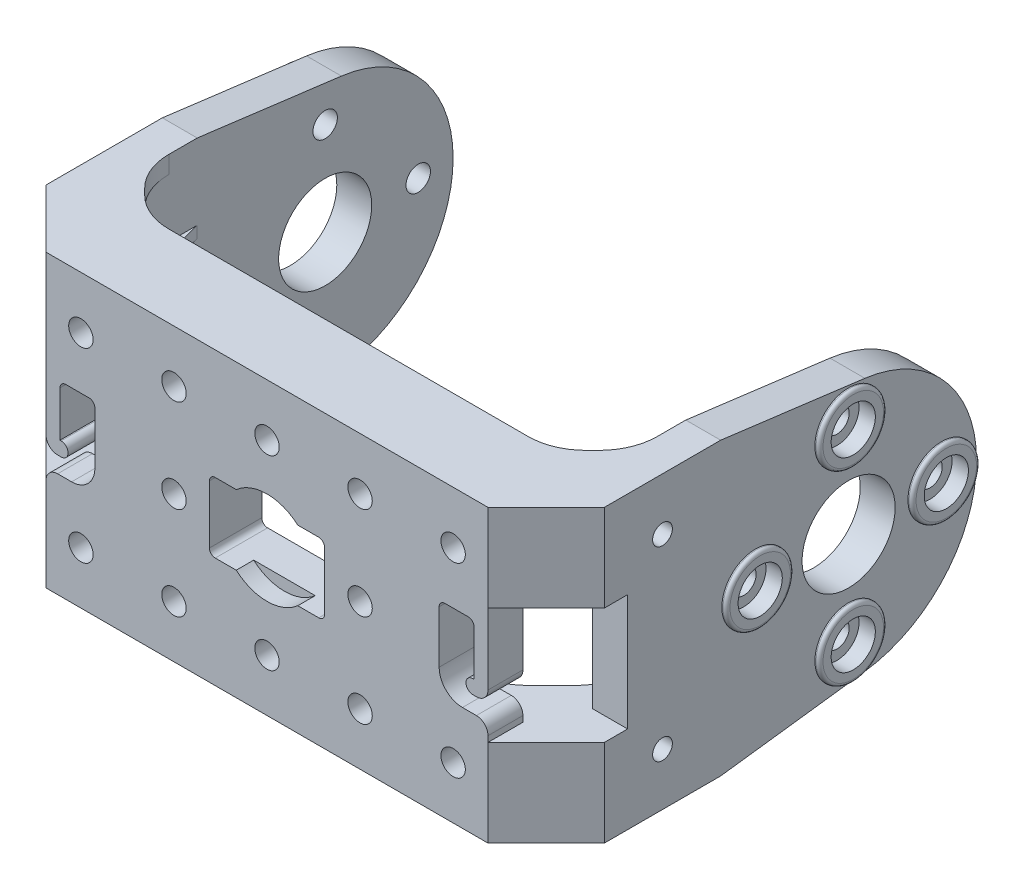
from build123d import *

# Parameters (mm, degrees)
BOSS_EXTRUDE1_DEPTH            = 1
BOSS_EXTRUDE2_DEPTH            = 0.5
CUT_EXTRUDE1_DEPTH             = 1
CUT_EXTRUDE2_DEPTH             = 1
CUT_EXTRUDE3_DEPTH             = 1
SKETCH6_W                      = 1.5
SKETCH6_H                      = 1.5
BOSS_EXTRUDE3_DEPTH            = 10.919112181
CUT_EXTRUDE4_DEPTH             = 1
BOSS_EXTRUDE4_DEPTH            = 7.5
BOSS_EXTRUDE5_DEPTH            = 7.5
CUT_EXTRUDE5_DEPTH             = 6
CUT_EXTRUDE6_DEPTH             = 6
BOSS_EXTRUDE6_DEPTH            = 3
BOSS_EXTRUDE7_START            = 3
BOSS_EXTRUDE7_DEPTH            = 3
CUT_EXTRUDE7_DEPTH             = 1.5
CUT_EXTRUDE8_DEPTH             = 1.5
CUT_EXTRUDE9_DEPTH             = 5
SKETCH17_W                     = 0.5
SKETCH17_H                     = 7
CUT_EXTRUDE10_DEPTH            = 1.743065645
CUT_EXTRUDE11_DEPTH            = 1.5
CUT_EXTRUDE12_DEPTH            = 1.5
CUT_EXTRUDE13_DEPTH            = 5
SKETCH21_W                     = 0.5
SKETCH21_H                     = 7
CUT_EXTRUDE14_DEPTH            = 2.337822174
SKETCH22_W                     = 0.5
SKETCH22_H                     = 7
CUT_EXTRUDE15_DEPTH            = 1.743065645
SKETCH23_W                     = 1.5
SKETCH23_H                     = 1.5
CUT_EXTRUDE16_DEPTH            = 8.985281374
SKETCH24_W                     = 0.5
SKETCH24_H                     = 7
CUT_EXTRUDE17_DEPTH            = 2.337822174
SKETCH25_W                     = 1.5
SKETCH25_H                     = 1.5
CUT_EXTRUDE18_DEPTH            = 0.419112181
BOSS_EXTRUDE8_DEPTH            = 3
CUT_EXTRUDE19_DEPTH            = 0.5
CUT_EXTRUDE20_DEPTH            = 1
CUT_EXTRUDE21_DEPTH            = 1
CUT_EXTRUDE22_DEPTH            = 1
CUT_EXTRUDE23_DEPTH            = 0.5
CUT_EXTRUDE24_DEPTH            = 1
CUT_EXTRUDE25_DEPTH            = 1
CUT_EXTRUDE26_DEPTH            = 1
CUT_EXTRUDE27_DEPTH            = 1
CUT_EXTRUDE28_DEPTH            = 1
CUT_EXTRUDE29_DEPTH            = 2
CUT_EXTRUDE30_DEPTH            = 1
CUT_EXTRUDE31_DEPTH            = 2
CUT_EXTRUDE32_DEPTH            = 1
CUT_EXTRUDE33_DEPTH            = 2
CUT_EXTRUDE34_DEPTH            = 1
CUT_EXTRUDE35_DEPTH            = 2
CUT_EXTRUDE36_DEPTH            = 1
CUT_EXTRUDE37_DEPTH            = 2
CUT_EXTRUDE38_DEPTH            = 1
CUT_EXTRUDE39_DEPTH            = 1
CUT_EXTRUDE40_DEPTH            = 2
CUT_EXTRUDE41_DEPTH            = 1
CUT_EXTRUDE42_DEPTH            = 1
SKETCH51_W                     = 9.9
SKETCH51_H                     = 6
CUT_EXTRUDE43_DEPTH            = 46.839393539
CUT_EXTRUDE44_DEPTH            = 1.5
CUT_EXTRUDE45_DEPTH            = 1.5
CUT_EXTRUDE46_DEPTH            = 2
CUT_EXTRUDE47_DEPTH            = 2
CUT_EXTRUDE48_DEPTH            = 2
CUT_EXTRUDE49_DEPTH            = 2
CUT_EXTRUDE50_DEPTH            = 2
CUT_EXTRUDE51_DEPTH            = 2
DRAFT1_ANGLE                   = 71.621107155
SKETCH60_W                     = 0.4
SKETCH60_H                     = 2.9
SKETCH61_W                     = 0.4
SKETCH61_H                     = 2.9
SKETCH62_W                     = 0.4
SKETCH62_H                     = 2.9
SKETCH63_W                     = 0.4
SKETCH63_H                     = 2.9
SKETCH64_W                     = 0.4
SKETCH64_H                     = 2.9
SKETCH65_W                     = 0.4
SKETCH65_H                     = 2.9
SKETCH66_W                     = 0.4
SKETCH66_H                     = 2.9
SKETCH67_W                     = 0.4
SKETCH67_H                     = 2.9
F_1_7_1_7_DIAMETER_HOLE1_D     = 1.7
F_1_7_1_7_DIAMETER_HOLE1_DEPTH = 3
F_1_7_1_7_DIAMETER_HOLE2_D     = 1.7
F_1_7_1_7_DIAMETER_HOLE2_DEPTH = 3.4
F_2_1_2_1_DIAMETER_HOLE1_D     = 2.1
F_2_1_2_1_DIAMETER_HOLE1_DEPTH = 37
HOLE1_D                        = 2.1
HOLE1_DEPTH                    = 3.4
HOLE1_CBORE_D                  = 3.8
HOLE1_CBORE_DEPTH              = 1.4
HOLE2_D                        = 2.1
HOLE2_DEPTH                    = 48.8
HOLE2_CBORE_D                  = 3.8
HOLE2_CBORE_DEPTH              = 1.4
F_8_0_8_DIAMETER_HOLE1_D       = 8
F_8_0_8_DIAMETER_HOLE1_DEPTH   = 3
F_8_0_8_DIAMETER_HOLE2_D       = 8
F_8_0_8_DIAMETER_HOLE2_DEPTH   = 3.4
CHAMFER1_SIZE                  = 5
FILLET1_R                      = 0.3
FILLET2_R                      = 0.5
FILLET3_R                      = 1
FILLET4_R                      = 2
FILLET5_R                      = 5


with BuildPart() as part:
    # Sketch1 → Boss-Extrude1 (new body)
    with BuildSketch(Plane.XY.offset(23)):
        Polygon((-14.595606444, -5), (10.080887819, -5), (10.080887819, -2.493640581), (11.2, -1.847520861), (11.2, 1.847520861), (10.080887819, 2.493640581), (10.080887819, 3.5), (14.595606444, 5), (-14.595606444, 5), (-10.080887819, 3.5), (-10.080887819, 2.493640581), (-11.2, 1.847520861), (-11.2, -1.847520861), (-10.080887819, -2.493640581), (-10.080887819, -3.5), align=None)
    extrude(amount=-BOSS_EXTRUDE1_DEPTH)

    # Sketch2 → Boss-Extrude2 (add)
    with BuildSketch(Plane(origin=(0, 0, 22), x_dir=(-1, 0, 0), z_dir=(0, 0, -1))):
        Polygon((-10.080887819, -5), (-10.080887819, 3.5), (-14.595606444, 5), (14.595606444, 5), (10.080887819, 3.5), (10.080887819, -3.5), (14.595606444, -5), align=None)
    extrude(amount=BOSS_EXTRUDE2_DEPTH)

    # Sketch3 → Cut-Extrude1 (cut)
    with BuildSketch(Plane.XY.offset(23)):
        Polygon((-8.337822174, -3.5), (-10.080887819, -2.493640581), (-10.080887819, -3.5), align=None)
    extrude(amount=-CUT_EXTRUDE1_DEPTH, mode=Mode.SUBTRACT)

    # Sketch4 → Cut-Extrude2 (cut)
    with BuildSketch(Plane.XY.offset(23)):
        Polygon((-10.080887819, 2.493640581), (-8.337822174, 3.5), (-10.080887819, 3.5), align=None)
    extrude(amount=-CUT_EXTRUDE2_DEPTH, mode=Mode.SUBTRACT)

    # Sketch5 → Cut-Extrude3 (cut)
    with BuildSketch(Plane.XY.offset(23)):
        Polygon((10.080887819, -2.493640581), (8.337822174, -3.5), (10.080887819, -3.5), align=None)
    extrude(amount=-CUT_EXTRUDE3_DEPTH, mode=Mode.SUBTRACT)

    # Sketch6 → Boss-Extrude3 (add)
    with BuildSketch(Plane(origin=(10.080887819, 0, 0), x_dir=(0, 0, -1), z_dir=(1, 0, 0))):
        with Locations((-22.25, -4.25)):
            Rectangle(SKETCH6_W, SKETCH6_H)
    extrude(amount=BOSS_EXTRUDE3_DEPTH)

    # Sketch7 → Cut-Extrude4 (cut)
    with BuildSketch(Plane.XY.offset(23)):
        Polygon((8.337822174, 3.5), (10.080887819, 2.493640581), (10.080887819, 3.5), align=None)
    extrude(amount=-CUT_EXTRUDE4_DEPTH, mode=Mode.SUBTRACT)

    # Sketch8 → Boss-Extrude4 (add)
    with BuildSketch(Plane.XZ.offset(5)):
        Polygon((-21, 11), (-21, 23), (21, 23), (21, 11), (19.5, 17.014718626), (17.514718626, 19), (-17.514718626, 19), (-19.5, 17.014718626), align=None)
    extrude(amount=BOSS_EXTRUDE4_DEPTH)

    # Sketch9 → Boss-Extrude5 (add)
    with BuildSketch(Plane(origin=(0, 5, 0), x_dir=(-1, 0, 0), z_dir=(0, 1, 0))):
        Polygon((21, 23), (21, 11), (19.5, 17.014718626), (17.514718626, 19), (-17.514718626, 19), (-19.5, 17.014718626), (-21, 11), (-21, 23), align=None)
    extrude(amount=BOSS_EXTRUDE5_DEPTH)

    # Sketch10 → Cut-Extrude5 (cut)
    with BuildSketch(Plane(origin=(0, -5, 0), x_dir=(-1, 0, 0), z_dir=(0, 1, 0))):
        Polygon((-17.514718626, 19), (17.514718626, 19), (15.014718626, 21.5), (-15.014718626, 21.5), align=None)
    extrude(amount=-CUT_EXTRUDE5_DEPTH, mode=Mode.SUBTRACT)

    # Sketch11 → Cut-Extrude6 (cut)
    with BuildSketch(Plane.XZ.offset(-5)):
        Polygon((-17.514718626, 19), (17.514718626, 19), (15.014718626, 21.5), (-15.014718626, 21.5), align=None)
    extrude(amount=-CUT_EXTRUDE6_DEPTH, mode=Mode.SUBTRACT)

    # Sketch12 → Boss-Extrude6 (add)
    with BuildSketch(Plane.ZY.offset(21)):
        with BuildLine():
            Line((23, 12.5), (23, 5))
            Line((23, 5), (19, 5))
            Line((19, 5), (19, -5))
            Line((19, -5), (23, -5))
            Line((23, -5), (23, -12.5))
            Line((23, -12.5), (11, -12.5))
            Line((11, -12.5), (-1.398557259, -10.910730388))
            ThreePointArc((-1.398557259, -10.910730388), (-11, 0), (-1.398557259, 10.910730388))
            Line((-1.398557259, 10.910730388), (11, 12.5))
            Line((11, 12.5), (23, 12.5))
        make_face()
    extrude(amount=BOSS_EXTRUDE6_DEPTH)

    # Sketch13 → Boss-Extrude7 (add)
    with BuildSketch(Plane(origin=(21, 0, 0), x_dir=(0, 0, -1), z_dir=(1, 0, 0)).offset(BOSS_EXTRUDE7_START)):
        with BuildLine():
            Line((-23, 12.5), (-11, 12.5))
            Line((-11, 12.5), (1.398557259, 10.910730388))
            ThreePointArc((1.398557259, 10.910730388), (11, 0), (1.398557259, -10.910730388))
            Line((1.398557259, -10.910730388), (-11, -12.5))
            Line((-11, -12.5), (-23, -12.5))
            Line((-23, -12.5), (-23, -3.5))
            Line((-23, -3.5), (-21.5, -3.5))
            Line((-21.5, -3.5), (-21.5, -5))
            Line((-21.5, -5), (-19, -5))
            Line((-19, -5), (-19, 5))
            Line((-19, 5), (-23, 5))
            Line((-23, 5), (-23, 12.5))
        make_face()
    extrude(amount=-BOSS_EXTRUDE7_DEPTH)

    # Sketch14 → Cut-Extrude7 (cut)
    with BuildSketch(Plane(origin=(0, 12.5, 0), x_dir=(-1, 0, 0), z_dir=(0, 1, 0))):
        Polygon((21, 11), (21, 15.514718626), (19.5, 17.014718626), align=None)
    extrude(amount=-CUT_EXTRUDE7_DEPTH, mode=Mode.SUBTRACT)

    # Sketch15 → Cut-Extrude8 (cut)
    with BuildSketch(Plane(origin=(0, 12.5, 0), x_dir=(-1, 0, 0), z_dir=(0, 1, 0))):
        Polygon((-21, 11), (-19.5, 17.014718626), (-21, 15.514718626), align=None)
    extrude(amount=-CUT_EXTRUDE8_DEPTH, mode=Mode.SUBTRACT)

    # Sketch16 → Cut-Extrude9 (cut)
    with BuildSketch(Plane(origin=(0, 11, 0), x_dir=(-1, 0, 0), z_dir=(0, 1, 0))):
        Polygon((21, 22), (-21, 22), (-21, 11), (-19.5, 17.014718626), (-15.014718626, 21.5), (15.014718626, 21.5), (19.5, 17.014718626), (21, 11), align=None)
    extrude(amount=-CUT_EXTRUDE9_DEPTH, mode=Mode.SUBTRACT)

    # Sketch17 → Cut-Extrude10 (cut)
    with BuildSketch(Plane(origin=(10.080887819, 0, 0), x_dir=(0, 0, -1), z_dir=(1, 0, 0))):
        with Locations((-21.75, 0)):
            Rectangle(SKETCH17_W, SKETCH17_H)
    extrude(amount=-CUT_EXTRUDE10_DEPTH, mode=Mode.SUBTRACT)

    # Sketch18 → Cut-Extrude11 (cut)
    with BuildSketch(Plane.XZ.offset(12.5)):
        Polygon((-19.5, 17.014718626), (-21, 15.514718626), (-21, 11), align=None)
    extrude(amount=-CUT_EXTRUDE11_DEPTH, mode=Mode.SUBTRACT)

    # Sketch19 → Cut-Extrude12 (cut)
    with BuildSketch(Plane.XZ.offset(12.5)):
        Polygon((21, 15.514718626), (19.5, 17.014718626), (21, 11), align=None)
    extrude(amount=-CUT_EXTRUDE12_DEPTH, mode=Mode.SUBTRACT)

    # Sketch20 → Cut-Extrude13 (cut)
    with BuildSketch(Plane.XZ.offset(11)):
        Polygon((21, 22), (-21, 22), (-21, 11), (-19.5, 17.014718626), (-15.014718626, 21.5), (15.014718626, 21.5), (19.5, 17.014718626), (21, 11), align=None)
    extrude(amount=-CUT_EXTRUDE13_DEPTH, mode=Mode.SUBTRACT)

    # Sketch21 → Cut-Extrude14 (cut)
    with BuildSketch(Plane(origin=(8.337822174, 0, 0), x_dir=(0, 0, -1), z_dir=(1, 0, 0))):
        with Locations((-21.75, 0)):
            Rectangle(SKETCH21_W, SKETCH21_H)
    extrude(amount=-CUT_EXTRUDE14_DEPTH, mode=Mode.SUBTRACT)

    # Sketch22 → Cut-Extrude15 (cut)
    with BuildSketch(Plane.ZY.offset(10.080887819)):
        with Locations((21.75, 0)):
            Rectangle(SKETCH22_W, SKETCH22_H)
    extrude(amount=-CUT_EXTRUDE15_DEPTH, mode=Mode.SUBTRACT)

    # Sketch23 → Cut-Extrude16 (cut)
    with BuildSketch(Plane(origin=(24, 0, 0), x_dir=(0, 0, -1), z_dir=(1, 0, 0))):
        with Locations((-22.25, -4.25)):
            Rectangle(SKETCH23_W, SKETCH23_H)
    extrude(amount=-CUT_EXTRUDE16_DEPTH, mode=Mode.SUBTRACT)

    # Sketch24 → Cut-Extrude17 (cut)
    with BuildSketch(Plane.ZY.offset(8.337822174)):
        with Locations((21.75, 0)):
            Rectangle(SKETCH24_W, SKETCH24_H)
    extrude(amount=-CUT_EXTRUDE17_DEPTH, mode=Mode.SUBTRACT)

    # Sketch25 → Cut-Extrude18 (cut)
    with BuildSketch(Plane(origin=(15.014718626, 0, 0), x_dir=(0, 0, -1), z_dir=(1, 0, 0))):
        with Locations((-22.25, -4.25)):
            Rectangle(SKETCH25_W, SKETCH25_H)
    extrude(amount=-CUT_EXTRUDE18_DEPTH, mode=Mode.SUBTRACT)

    # Sketch26 → Boss-Extrude8 (add)
    with BuildSketch(Plane.XY.offset(23)):
        with BuildLine():
            Line((14.8, 3.5), (14.8, -3.5))
            Line((14.8, -3.5), (19, -3.5))
            Line((19, -3.5), (19, -5))
            Line((19, -5), (24, -5))
            Line((24, -5), (24, -12.5))
            Line((24, -12.5), (-24, -12.5))
            Line((-24, -12.5), (-24, -5))
            Line((-24, -5), (-19, -5))
            Line((-19, -5), (-19, -3.5))
            Line((-19, -3.5), (-14.8, -3.5))
            Line((-14.8, -3.5), (-14.8, 3.5))
            Line((-14.8, 3.5), (-17.8, 3.5))
            Line((-17.8, 3.5), (-17.8, -0.9))
            Line((-17.8, -0.9), (-17.7, -0.9))
            ThreePointArc((-17.7, -0.9), (-17.1, -1.5), (-17.7, -2.1))
            Line((-17.7, -2.1), (-19, -2.1))
            Line((-19, -2.1), (-19, 5))
            Line((-19, 5), (-24, 5))
            Line((-24, 5), (-24, 12.5))
            Line((-24, 12.5), (24, 12.5))
            Line((24, 12.5), (24, 5))
            Line((24, 5), (19, 5))
            Line((19, 5), (19, -2.1))
            Line((19, -2.1), (17.7, -2.1))
            ThreePointArc((17.7, -2.1), (17.1, -1.5), (17.7, -0.9))
            Line((17.7, -0.9), (17.8, -0.9))
            Line((17.8, -0.9), (17.8, 3.5))
            Line((17.8, 3.5), (14.8, 3.5))
        make_face()
    extrude(amount=BOSS_EXTRUDE8_DEPTH)

    # Sketch27 → Cut-Extrude19 (cut)
    with BuildSketch(Plane(origin=(0, 0, 21.5), x_dir=(-1, 0, 0), z_dir=(0, 0, -1))):
        Polygon((-9.919112181, 4.5), (9.919112181, 4.5), (14.433830807, 6), (-14.433830807, 6), align=None)
    extrude(amount=-CUT_EXTRUDE19_DEPTH, mode=Mode.SUBTRACT)

    # Sketch28 → Cut-Extrude20 (cut)
    with BuildSketch(Plane(origin=(0, 0, 22), x_dir=(-1, 0, 0), z_dir=(0, 0, -1))):
        Polygon((9.919112181, 4.5), (13.810221356, 5.792807868), (12.535898385, 8), (14.267949192, 11), (9.203847577, 11), (11.2, 9.847520861), (11.2, 6.152479139), (8.337822174, 4.5), align=None)
    extrude(amount=-CUT_EXTRUDE20_DEPTH, mode=Mode.SUBTRACT)

    # Sketch29 → Cut-Extrude21 (cut)
    with BuildSketch(Plane(origin=(0, 0, 22), x_dir=(-1, 0, 0), z_dir=(0, 0, -1))):
        Polygon((7.662177826, 4.5), (4.8, 6.152479139), (4.8, 9.847520861), (6.796152423, 11), (1.203847577, 11), (3.2, 9.847520861), (3.2, 6.152479139), (0.337822174, 4.5), align=None)
    extrude(amount=-CUT_EXTRUDE21_DEPTH, mode=Mode.SUBTRACT)

    # Sketch30 → Cut-Extrude22 (cut)
    with BuildSketch(Plane(origin=(0, 0, 22), x_dir=(-1, 0, 0), z_dir=(0, 0, -1))):
        Polygon((-8.337822174, 4.5), (-11.2, 6.152479139), (-11.2, 9.847520861), (-9.203847577, 11), (-14.267949192, 11), (-12.535898385, 8), (-13.810221356, 5.792807868), (-9.919112181, 4.5), align=None)
    extrude(amount=-CUT_EXTRUDE22_DEPTH, mode=Mode.SUBTRACT)

    # Sketch31 → Cut-Extrude23 (cut)
    with BuildSketch(Plane(origin=(0, 0, 21.5), x_dir=(-1, 0, 0), z_dir=(0, 0, -1))):
        Polygon((9.919112181, -4.5), (-9.919112181, -4.5), (-14.433830807, -6), (14.433830807, -6), align=None)
    extrude(amount=-CUT_EXTRUDE23_DEPTH, mode=Mode.SUBTRACT)

    # Sketch32 → Cut-Extrude24 (cut)
    with BuildSketch(Plane(origin=(0, 0, 22), x_dir=(-1, 0, 0), z_dir=(0, 0, -1))):
        Polygon((-7.662177826, -4.5), (-4.8, -6.152479139), (-4.8, -9.847520861), (-6.796152423, -11), (-1.203847577, -11), (-3.2, -9.847520861), (-3.2, -6.152479139), (-0.337822174, -4.5), align=None)
    extrude(amount=-CUT_EXTRUDE24_DEPTH, mode=Mode.SUBTRACT)

    # Sketch33 → Cut-Extrude25 (cut)
    with BuildSketch(Plane(origin=(0, 0, 22), x_dir=(-1, 0, 0), z_dir=(0, 0, -1))):
        Polygon((-9.919112181, -4.5), (-13.810221356, -5.792807868), (-12.535898385, -8), (-14.267949192, -11), (-9.203847577, -11), (-11.2, -9.847520861), (-11.2, -6.152479139), (-8.337822174, -4.5), align=None)
    extrude(amount=-CUT_EXTRUDE25_DEPTH, mode=Mode.SUBTRACT)

    # Sketch34 → Cut-Extrude26 (cut)
    with BuildSketch(Plane(origin=(0, 0, 22), x_dir=(-1, 0, 0), z_dir=(0, 0, -1))):
        Polygon((-0.337822174, 4.5), (-3.2, 6.152479139), (-3.2, 9.847520861), (-1.203847577, 11), (-6.796152423, 11), (-4.8, 9.847520861), (-4.8, 6.152479139), (-7.662177826, 4.5), align=None)
    extrude(amount=-CUT_EXTRUDE26_DEPTH, mode=Mode.SUBTRACT)

    # Sketch35 → Cut-Extrude27 (cut)
    with BuildSketch(Plane(origin=(0, 0, 22), x_dir=(-1, 0, 0), z_dir=(0, 0, -1))):
        Polygon((8.337822174, -4.5), (11.2, -6.152479139), (11.2, -9.847520861), (9.203847577, -11), (14.267949192, -11), (12.535898385, -8), (13.810221356, -5.792807868), (9.919112181, -4.5), align=None)
    extrude(amount=-CUT_EXTRUDE27_DEPTH, mode=Mode.SUBTRACT)

    # Sketch36 → Cut-Extrude28 (cut)
    with BuildSketch(Plane(origin=(0, 0, 22), x_dir=(-1, 0, 0), z_dir=(0, 0, -1))):
        Polygon((0.337822174, -4.5), (3.2, -6.152479139), (3.2, -9.847520861), (1.203847577, -11), (6.796152423, -11), (4.8, -9.847520861), (4.8, -6.152479139), (7.662177826, -4.5), align=None)
    extrude(amount=-CUT_EXTRUDE28_DEPTH, mode=Mode.SUBTRACT)

    # Sketch37 → Cut-Extrude29 (cut)
    with BuildSketch(Plane(origin=(0, 0, 22), x_dir=(-1, 0, 0), z_dir=(0, 0, -1))):
        Polygon((-13.690598923, -8), (-14.845299462, -6), (-17.154700538, -6), (-18.309401077, -8), (-17.154700538, -10), (-14.845299462, -10), align=None)
    extrude(amount=-CUT_EXTRUDE29_DEPTH, mode=Mode.SUBTRACT)

    # Sketch38 → Cut-Extrude30 (cut)
    with BuildSketch(Plane(origin=(0, 0, 22), x_dir=(-1, 0, 0), z_dir=(0, 0, -1))):
        Polygon((-17.732050808, -11), (-19.464101615, -8), (-18.309401077, -6), (-21, -6), (-21, -11), align=None)
    extrude(amount=-CUT_EXTRUDE30_DEPTH, mode=Mode.SUBTRACT)

    # Sketch39 → Cut-Extrude31 (cut)
    with BuildSketch(Plane(origin=(0, 0, 22), x_dir=(-1, 0, 0), z_dir=(0, 0, -1))):
        Polygon((-14.845299462, 10), (-17.154700538, 10), (-18.309401077, 8), (-17.154700538, 6), (-14.845299462, 6), (-13.690598923, 8), align=None)
    extrude(amount=-CUT_EXTRUDE31_DEPTH, mode=Mode.SUBTRACT)

    # Sketch40 → Cut-Extrude32 (cut)
    with BuildSketch(Plane(origin=(0, 0, 22), x_dir=(-1, 0, 0), z_dir=(0, 0, -1))):
        Polygon((-17.732050808, 11), (-21, 11), (-21, 6), (-18.309401077, 6), (-19.464101615, 8), align=None)
    extrude(amount=-CUT_EXTRUDE32_DEPTH, mode=Mode.SUBTRACT)

    # Sketch41 → Cut-Extrude33 (cut)
    with BuildSketch(Plane(origin=(0, 0, 22), x_dir=(-1, 0, 0), z_dir=(0, 0, -1))):
        Polygon((13.690598923, 8), (14.845299462, 6), (17.154700538, 6), (18.309401077, 8), (17.154700538, 10), (14.845299462, 10), align=None)
    extrude(amount=-CUT_EXTRUDE33_DEPTH, mode=Mode.SUBTRACT)

    # Sketch42 → Cut-Extrude34 (cut)
    with BuildSketch(Plane(origin=(0, 0, 22), x_dir=(-1, 0, 0), z_dir=(0, 0, -1))):
        Polygon((17.732050808, 11), (19.464101615, 8), (18.309401077, 6), (21, 6), (21, 11), align=None)
    extrude(amount=-CUT_EXTRUDE34_DEPTH, mode=Mode.SUBTRACT)

    # Sketch43 → Cut-Extrude35 (cut)
    with BuildSketch(Plane(origin=(0, 0, 22), x_dir=(-1, 0, 0), z_dir=(0, 0, -1))):
        Polygon((14.845299462, -10), (17.154700538, -10), (18.309401077, -8), (17.154700538, -6), (14.845299462, -6), (13.690598923, -8), align=None)
    extrude(amount=-CUT_EXTRUDE35_DEPTH, mode=Mode.SUBTRACT)

    # Sketch44 → Cut-Extrude36 (cut)
    with BuildSketch(Plane(origin=(0, 0, 22), x_dir=(-1, 0, 0), z_dir=(0, 0, -1))):
        Polygon((17.732050808, -11), (21, -11), (21, -6), (18.309401077, -6), (19.464101615, -8), align=None)
    extrude(amount=-CUT_EXTRUDE36_DEPTH, mode=Mode.SUBTRACT)

    # Sketch45 → Cut-Extrude37 (cut)
    with BuildSketch(Plane(origin=(0, 0, 22), x_dir=(-1, 0, 0), z_dir=(0, 0, -1))):
        Polygon((-8, 2.309401077), (-10, 1.154700538), (-10, -1.154700538), (-8, -2.309401077), (-6, -1.154700538), (-6, 1.154700538), align=None)
    extrude(amount=-CUT_EXTRUDE37_DEPTH, mode=Mode.SUBTRACT)

    # Sketch46 → Cut-Extrude38 (cut)
    with BuildSketch(Plane(origin=(0, 0, 22), x_dir=(-1, 0, 0), z_dir=(0, 0, -1))):
        Polygon((-6, 3.5), (-7.662177826, 3.5), (-6, 2.540341184), align=None)
    extrude(amount=-CUT_EXTRUDE38_DEPTH, mode=Mode.SUBTRACT)

    # Sketch47 → Cut-Extrude39 (cut)
    with BuildSketch(Plane(origin=(0, 0, 22), x_dir=(-1, 0, 0), z_dir=(0, 0, -1))):
        Polygon((-6, -2.540341184), (-7.662177826, -3.5), (-6, -3.5), align=None)
    extrude(amount=-CUT_EXTRUDE39_DEPTH, mode=Mode.SUBTRACT)

    # Sketch48 → Cut-Extrude40 (cut)
    with BuildSketch(Plane(origin=(0, 0, 22), x_dir=(-1, 0, 0), z_dir=(0, 0, -1))):
        Polygon((8, 2.309401077), (6, 1.154700538), (6, -1.154700538), (8, -2.309401077), (10, -1.154700538), (10, 1.154700538), align=None)
    extrude(amount=-CUT_EXTRUDE40_DEPTH, mode=Mode.SUBTRACT)

    # Sketch49 → Cut-Extrude41 (cut)
    with BuildSketch(Plane(origin=(0, 0, 22), x_dir=(-1, 0, 0), z_dir=(0, 0, -1))):
        Polygon((6, -3.5), (7.662177826, -3.5), (6, -2.540341184), align=None)
    extrude(amount=-CUT_EXTRUDE41_DEPTH, mode=Mode.SUBTRACT)

    # Sketch50 → Cut-Extrude42 (cut)
    with BuildSketch(Plane(origin=(0, 0, 22), x_dir=(-1, 0, 0), z_dir=(0, 0, -1))):
        Polygon((6, 2.540341184), (7.662177826, 3.5), (6, 3.5), align=None)
    extrude(amount=-CUT_EXTRUDE42_DEPTH, mode=Mode.SUBTRACT)

    # Sketch51 → Cut-Extrude43 (cut, through all)
    with BuildSketch(Plane.XY.offset(26)):
        Rectangle(SKETCH51_W, SKETCH51_H)
    extrude(amount=-CUT_EXTRUDE43_DEPTH, mode=Mode.SUBTRACT)

    # Sketch52 → Cut-Extrude44 (cut)
    with BuildSketch(Plane.XY.offset(26)):
        with BuildLine():
            Line((2.645751311, -3), (-2.645751311, -3))
            ThreePointArc((-2.645751311, -3), (0, -4), (2.645751311, -3))
        make_face()
    extrude(amount=-CUT_EXTRUDE44_DEPTH, mode=Mode.SUBTRACT)

    # Sketch53 → Cut-Extrude45 (cut)
    with BuildSketch(Plane.XY.offset(26)):
        with BuildLine():
            Line((-2.645751311, 3), (2.645751311, 3))
            ThreePointArc((2.645751311, 3), (0, 4), (-2.645751311, 3))
        make_face()
    extrude(amount=-CUT_EXTRUDE45_DEPTH, mode=Mode.SUBTRACT)

    # Sketch54 → Cut-Extrude46 (cut)
    with BuildSketch(Plane(origin=(0, 0, 22), x_dir=(-1, 0, 0), z_dir=(0, 0, -1))):
        Polygon((2, -6.845299462), (0, -5.690598923), (-2, -6.845299462), (-2, -9.154700538), (0, -10.309401077), (2, -9.154700538), align=None)
    extrude(amount=-CUT_EXTRUDE46_DEPTH, mode=Mode.SUBTRACT)

    # Sketch55 → Cut-Extrude47 (cut)
    with BuildSketch(Plane(origin=(0, 0, 22), x_dir=(-1, 0, 0), z_dir=(0, 0, -1))):
        Polygon((-6, 9.154700538), (-8, 10.309401077), (-10, 9.154700538), (-10, 6.845299462), (-8, 5.690598923), (-6, 6.845299462), align=None)
    extrude(amount=-CUT_EXTRUDE47_DEPTH, mode=Mode.SUBTRACT)

    # Sketch56 → Cut-Extrude48 (cut)
    with BuildSketch(Plane(origin=(0, 0, 22), x_dir=(-1, 0, 0), z_dir=(0, 0, -1))):
        Polygon((2, 9.154700538), (0, 10.309401077), (-2, 9.154700538), (-2, 6.845299462), (0, 5.690598923), (2, 6.845299462), align=None)
    extrude(amount=-CUT_EXTRUDE48_DEPTH, mode=Mode.SUBTRACT)

    # Sketch57 → Cut-Extrude49 (cut)
    with BuildSketch(Plane(origin=(0, 0, 22), x_dir=(-1, 0, 0), z_dir=(0, 0, -1))):
        Polygon((10, 9.154700538), (8, 10.309401077), (6, 9.154700538), (6, 6.845299462), (8, 5.690598923), (10, 6.845299462), align=None)
    extrude(amount=-CUT_EXTRUDE49_DEPTH, mode=Mode.SUBTRACT)

    # Sketch58 → Cut-Extrude50 (cut)
    with BuildSketch(Plane(origin=(0, 0, 22), x_dir=(-1, 0, 0), z_dir=(0, 0, -1))):
        Polygon((10, -6.845299462), (8, -5.690598923), (6, -6.845299462), (6, -9.154700538), (8, -10.309401077), (10, -9.154700538), align=None)
    extrude(amount=-CUT_EXTRUDE50_DEPTH, mode=Mode.SUBTRACT)

    # Sketch59 → Cut-Extrude51 (cut)
    with BuildSketch(Plane(origin=(0, 0, 22), x_dir=(-1, 0, 0), z_dir=(0, 0, -1))):
        Polygon((-6, -6.845299462), (-8, -5.690598923), (-10, -6.845299462), (-10, -9.154700538), (-8, -10.309401077), (-6, -9.154700538), align=None)
    extrude(amount=-CUT_EXTRUDE51_DEPTH, mode=Mode.SUBTRACT)

    # Draft1
    draft1_faces = [part.faces().sort_by_distance(p)[0] for p in [
        (14.595606444, -4.25, 22.25),
    ]]
    draft(draft1_faces, Plane.ZX.offset(-5), DRAFT1_ANGLE)

    # Sketch60 → Revolve1 (revolve)
    with BuildSketch(Plane.XY, mode=Mode.PRIVATE) as revolve1_sk:
        with Locations((24.2, 9.45)):
            Rectangle(SKETCH60_W, SKETCH60_H)
    revolve(revolve1_sk.sketch.rotate(Axis((24, 8, 0), (1, 0, 0)), 270), axis=Axis((24, 8, 0), (1, 0, 0)))

    # Sketch61 → Revolve2 (revolve)
    with BuildSketch(Plane.XY.offset(-8), mode=Mode.PRIVATE) as revolve2_sk:
        with Locations((24.2, 1.45)):
            Rectangle(SKETCH61_W, SKETCH61_H)
    revolve(revolve2_sk.sketch.rotate(Axis((24, 0, -8), (1, 0, 0)), 270), axis=Axis((24, 0, -8), (1, 0, 0)))

    # Sketch62 → Revolve3 (revolve)
    with BuildSketch(Plane.XY, mode=Mode.PRIVATE) as revolve3_sk:
        with Locations((24.2, -6.55)):
            Rectangle(SKETCH62_W, SKETCH62_H)
    revolve(revolve3_sk.sketch.rotate(Axis((24, -8, 0), (1, 0, 0)), 270), axis=Axis((24, -8, 0), (1, 0, 0)))

    # Sketch63 → Revolve4 (revolve)
    with BuildSketch(Plane.XY.offset(8), mode=Mode.PRIVATE) as revolve4_sk:
        with Locations((24.2, 1.45)):
            Rectangle(SKETCH63_W, SKETCH63_H)
    revolve(revolve4_sk.sketch.rotate(Axis((24, 0, 8), (1, 0, 0)), 270), axis=Axis((24, 0, 8), (1, 0, 0)))

    # Sketch64 → Revolve5 (revolve)
    with BuildSketch(Plane(origin=(0, 0, -8), x_dir=(-1, 0, 0), z_dir=(0, 0, -1)), mode=Mode.PRIVATE) as revolve5_sk:
        with Locations((24.2, 1.45)):
            Rectangle(SKETCH64_W, SKETCH64_H)
    revolve(revolve5_sk.sketch.rotate(Axis((-24, 0, -8), (-1, 0, 0)), 270), axis=Axis((-24, 0, -8), (-1, 0, 0)))

    # Sketch65 → Revolve6 (revolve)
    with BuildSketch(Plane(origin=(0, 0, 0), x_dir=(-1, 0, 0), z_dir=(0, 0, -1)), mode=Mode.PRIVATE) as revolve6_sk:
        with Locations((24.2, 9.45)):
            Rectangle(SKETCH65_W, SKETCH65_H)
    revolve(revolve6_sk.sketch.rotate(Axis((-24, 8, 0), (-1, 0, 0)), 270), axis=Axis((-24, 8, 0), (-1, 0, 0)))

    # Sketch66 → Revolve7 (revolve)
    with BuildSketch(Plane(origin=(0, 0, 8), x_dir=(-1, 0, 0), z_dir=(0, 0, -1)), mode=Mode.PRIVATE) as revolve7_sk:
        with Locations((24.2, 1.45)):
            Rectangle(SKETCH66_W, SKETCH66_H)
    revolve(revolve7_sk.sketch.rotate(Axis((-24, 0, 8), (-1, 0, 0)), 270), axis=Axis((-24, 0, 8), (-1, 0, 0)))

    # Sketch67 → Revolve8 (revolve)
    with BuildSketch(Plane(origin=(0, 0, 0), x_dir=(-1, 0, 0), z_dir=(0, 0, -1)), mode=Mode.PRIVATE) as revolve8_sk:
        with Locations((24.2, -6.55)):
            Rectangle(SKETCH67_W, SKETCH67_H)
    revolve(revolve8_sk.sketch.rotate(Axis((-24, -8, 0), (-1, 0, 0)), 270), axis=Axis((-24, -8, 0), (-1, 0, 0)))

    # Ø1.7 (1.7) Diameter Hole1
    with Locations(Plane(origin=(24, 0, 0), x_dir=(0, 0, -1), z_dir=(1, 0, 0))):
        with Locations((-16, -8), (-16, 8)):
            Hole(F_1_7_1_7_DIAMETER_HOLE1_D / 2, depth=F_1_7_1_7_DIAMETER_HOLE1_DEPTH)

    # Ø1.7 (1.7) Diameter Hole2
    with Locations(Plane(origin=(-21, 0, 0), x_dir=(0, 0, -1), z_dir=(1, 0, 0))):
        with Locations((-16, -8), (-16, 8)):
            Hole(F_1_7_1_7_DIAMETER_HOLE2_D / 2, depth=F_1_7_1_7_DIAMETER_HOLE2_DEPTH)

    # Ø2.1 (2.1) Diameter Hole1
    with Locations(Plane.XY.offset(26)):
        with Locations((0, -8), (8, 8), (0, 8), (-8, 8), (-8, -8), (8, -8), (-16, 8), (8, 0), (16, 8), (16, -8), (-8, 0), (-16, -8)):
            Hole(F_2_1_2_1_DIAMETER_HOLE1_D / 2, depth=F_2_1_2_1_DIAMETER_HOLE1_DEPTH)

    # Hole1
    with Locations(Plane(origin=(24.4, 0, 0), x_dir=(0, 0, -1), z_dir=(1, 0, 0))):
        with Locations((-8, 0), (0, -8), (8, 0), (0, 8)):
            CounterBoreHole(HOLE1_D / 2, HOLE1_CBORE_D / 2, HOLE1_CBORE_DEPTH, depth=HOLE1_DEPTH)

    # Hole2
    with Locations(Plane.ZY.offset(24.4)):
        with Locations((8, 0), (0, -8), (0, 8), (-8, 0)):
            CounterBoreHole(HOLE2_D / 2, HOLE2_CBORE_D / 2, HOLE2_CBORE_DEPTH, depth=HOLE2_DEPTH)

    # Ø8.0 (8) Diameter Hole1
    with Locations(Plane(origin=(24, 0, 0), x_dir=(0, 0, -1), z_dir=(1, 0, 0))):
        with Locations((0, 0)):
            Hole(F_8_0_8_DIAMETER_HOLE1_D / 2, depth=F_8_0_8_DIAMETER_HOLE1_DEPTH)

    # Ø8.0 (8) Diameter Hole2
    with Locations(Plane(origin=(-21, 0, 0), x_dir=(0, 0, -1), z_dir=(1, 0, 0))):
        with Locations((0, 0)):
            Hole(F_8_0_8_DIAMETER_HOLE2_D / 2, depth=F_8_0_8_DIAMETER_HOLE2_DEPTH)

    # Chamfer1
    chamfer1_edges = [part.edges().sort_by_distance(p)[0] for p in [
        (-24, 8.75, 26),
        (-24, -8.75, 26),
        (24, 8.75, 26),
        (24, -8.75, 26),
    ]]
    chamfer(chamfer1_edges, length=CHAMFER1_SIZE)

    # Fillet1
    fillet1_edges = [part.edges().sort_by_distance(p)[0] for p in [
        (24.4, 8, 2.9),
        (24.4, 0, -5.1),
        (24.4, -8, 2.9),
        (24.4, 0, 10.9),
        (-24.4, 0, -10.9),
        (-24.4, 8, -2.9),
        (-24.4, 0, 5.1),
        (-24.4, -8, -2.9),
    ]]
    fillet(fillet1_edges, radius=FILLET1_R)

    # Fillet2
    fillet2_edges = [part.edges().sort_by_distance(p)[0] for p in [
        (-4.95, 3, 23.75),
        (4.95, 3, 23.75),
        (4.95, -3, 23.75),
        (-4.95, -3, 23.75),
        (14.8, 3.5, 24.5),
        (17.8, 3.5, 24.5),
        (-17.8, 3.5, 24.5),
        (-14.8, 3.5, 24.5),
    ]]
    fillet(fillet2_edges, radius=FILLET2_R)

    # Fillet3
    fillet3_edges = [part.edges().sort_by_distance(p)[0] for p in [
        (19, -2.1, 24.5),
        (19, -3.5, 24.5),
        (-19, -3.5, 24.5),
        (-19, -2.1, 24.5),
    ]]
    fillet(fillet3_edges, radius=FILLET3_R)

    # Fillet4
    fillet4_edges = [part.edges().sort_by_distance(p)[0] for p in [
        (-14.8, -3.5, 24.5),
        (14.8, -3.5, 24.5),
    ]]
    fillet(fillet4_edges, radius=FILLET4_R)

    # Fillet5
    fillet5_edges = [part.edges().sort_by_distance(p)[0] for p in [
        (-17.514718626, -11.75, 19),
        (17.514718626, -11.75, 19),
        (17.514718626, 11.75, 19),
        (-17.514718626, 11.75, 19),
        (-21, 11.75, 15.514718626),
        (21, 11.75, 15.514718626),
        (-19.5, 5.5, 17.014718626),
        (-15.014718626, 5.5, 21.5),
        (15.014718626, 5.5, 21.5),
        (19.5, 5.5, 17.014718626),
        (-21, -11.75, 15.514718626),
        (21, -11.75, 15.514718626),
        (19.5, -5.5, 17.014718626),
        (15.014718626, -5.5, 21.5),
        (-15.014718626, -5.5, 21.5),
        (-19.5, -5.5, 17.014718626),
    ]]
    fillet(fillet5_edges, radius=FILLET5_R)


solid = part.part
